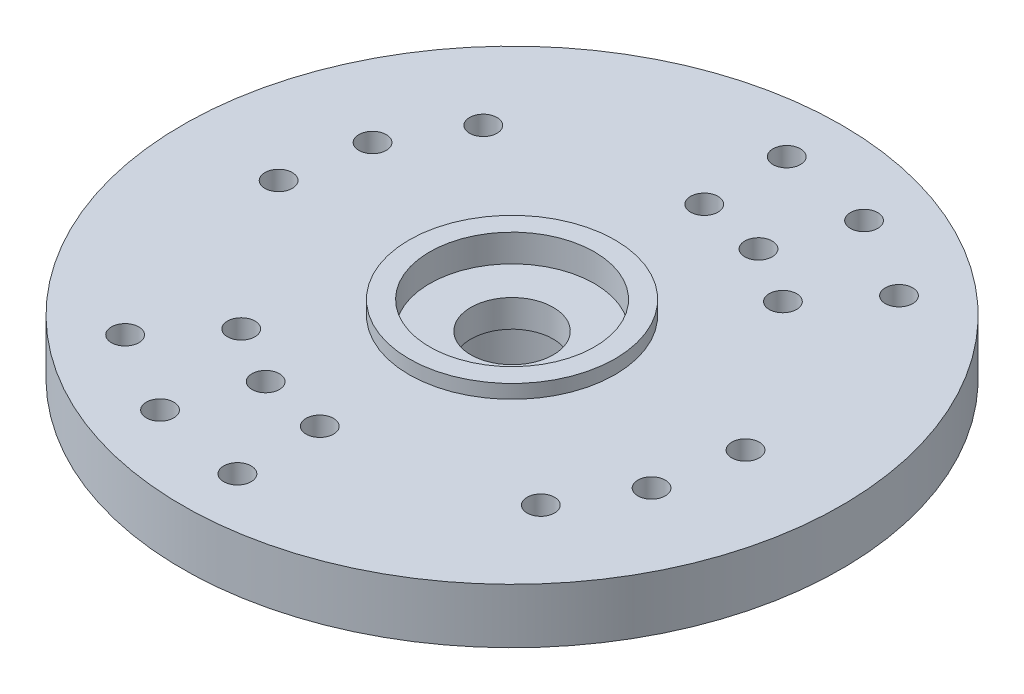
from build123d import *

# Parameters (mm, degrees)
ESQUISSE2_R                  = 0.5
ENL_V_MAT_EXTRU_1_DEPTH      = 10
R_P_TITION_CIRCULAIRE1_COUNT = 3
R_P_TITION_CIRCULAIRE1_ANGLE = 40


with BuildPart() as part:
    # Esquisse1 → Révolution1 (revolve)
    with BuildSketch(Plane.XY, mode=Mode.PRIVATE) as r_volution1_sk:
        Polygon((2.75, 0), (2.75, 3), (1.5, 3), (1.5, 4), (3, 4), (3, 5), (3.75, 5), (3.75, 4.5), (12, 4.5), (12, 2.5), (4.5, 2.5), (4.5, 0), align=None)
    revolve(r_volution1_sk.sketch.rotate(Axis((0, 0, 0), (0, 1, 0)), 90), axis=Axis((0, 0, 0), (0, 1, 0)))

    # Esquisse2 → Enlèv. mat.-Extru.1 (cut)
    with BuildSketch(Plane(origin=(0, 4.5, 0), x_dir=(1, 0, 0), z_dir=(0, 1, 0))):
        with Locations(Location((0, 10, 0), (0, 0, 270))):
            Circle(ESQUISSE2_R)
        with Locations(Location((8.5, 0, 0), (0, 0, 270))):
            Circle(ESQUISSE2_R)
        with Locations(Location((0, 7, 0), (0, 0, 270))):
            Circle(ESQUISSE2_R)
        with Locations(Location((0, -7, 0), (0, 0, 90))):
            Circle(ESQUISSE2_R)
        with Locations(Location((0, -10, 0), (0, 0, 90))):
            Circle(ESQUISSE2_R)
        with Locations(Location((-8.5, 0, 0), (0, 0, 90))):
            Circle(ESQUISSE2_R)
    enl_v_mat_extru_1 = extrude(amount=-ENL_V_MAT_EXTRU_1_DEPTH, mode=Mode.SUBTRACT)

    # Répétition circulaire1: Enlèv. mat.-Extru.1 ×3 about axis
    r_p_tition_circulaire1_axis = Axis((0, 0, 0), (0, -1, 0))
    for i in range(1, R_P_TITION_CIRCULAIRE1_COUNT):
        add(enl_v_mat_extru_1.rotate(r_p_tition_circulaire1_axis, i * R_P_TITION_CIRCULAIRE1_ANGLE / (R_P_TITION_CIRCULAIRE1_COUNT - 1)), mode=Mode.SUBTRACT)


solid = part.part
